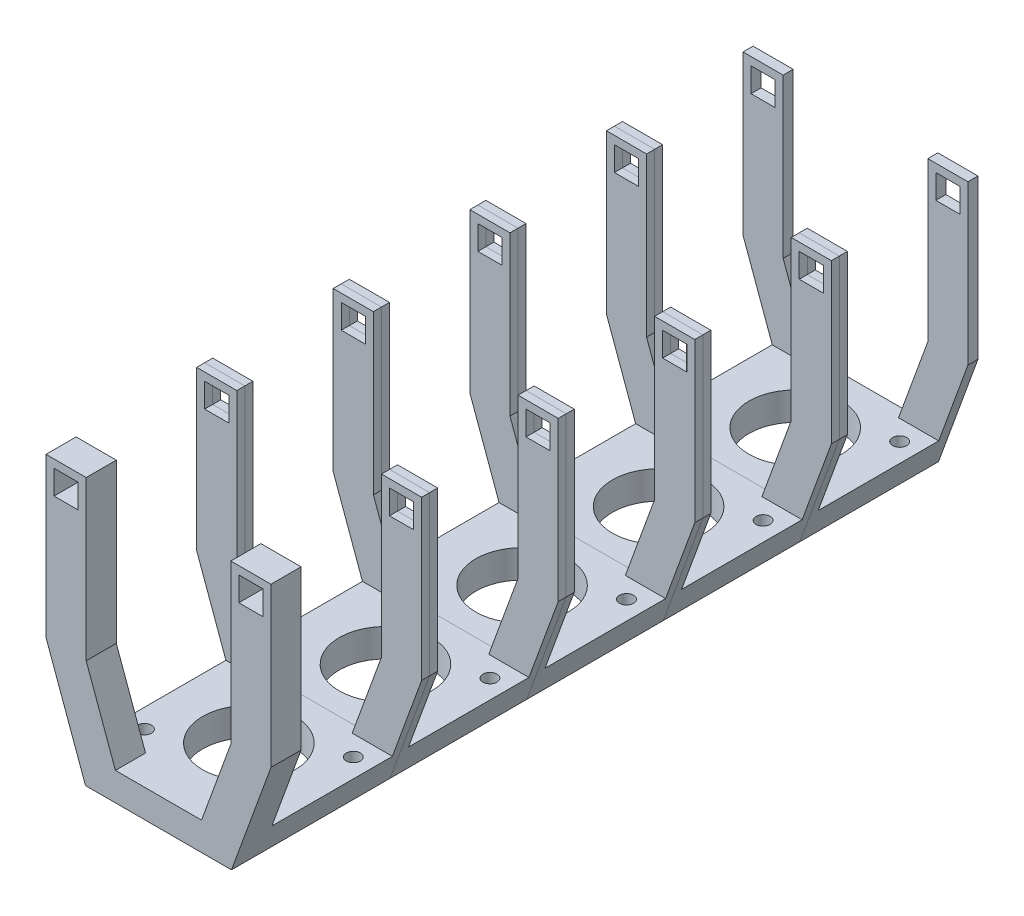
from build123d import *

# Parameters (mm, degrees)
SKETCH3_W           = 6
SKETCH3_H           = 6
BOSS_EXTRUDE1_DEPTH = 2
BOSS_EXTRUDE2_DEPTH = 30
SKETCH4_W           = 6
SKETCH4_H           = 6
BOSS_EXTRUDE6_DEPTH = 2
LPATTERN7_COUNT     = 5
LPATTERN7_PITCH     = 34
SKETCH12_W          = 6
SKETCH12_H          = 6
BOSS_EXTRUDE7_DEPTH = 0.5
SKETCH13_W          = 6
SKETCH13_H          = 6
BOSS_EXTRUDE8_DEPTH = 2
SKETCH15_R          = 11.5
SKETCH15_R_2        = 1.75
CUT_EXTRUDE5_DEPTH  = 7
LPATTERN8_COUNT     = 5
LPATTERN8_PITCH     = 34
SKETCH16_W          = 6
SKETCH16_H          = 6
BOSS_EXTRUDE9_DEPTH = 3.5


with BuildPart() as part:
    # Sketch3 → Boss-Extrude1 (new body)
    with BuildSketch(Plane.XY):
        Polygon((12.279404685, -25), (5, -5), (5, 34.5), (-5, 34.5), (-5, -5), (4.827196325, -32), (41.172803675, -32), (51, -5), (51, 34.5), (41, 34.5), (41, -5), (33.720595315, -25), align=None)
        with Locations((0, 29.5)):
            Rectangle(SKETCH3_W, SKETCH3_H, mode=Mode.SUBTRACT)
        with Locations((46, 29.5)):
            Rectangle(SKETCH3_W, SKETCH3_H, mode=Mode.SUBTRACT)
    extrude(amount=BOSS_EXTRUDE1_DEPTH)

    # Sketch3<4> → Boss-Extrude2 (add)
    with BuildSketch(Plane.XY):
        Polygon((33.720595315, -25), (12.279404685, -25), (2.279404685, -25), (4.827196325, -32), (41.172803675, -32), (43.720595315, -25), align=None)
    extrude(amount=-BOSS_EXTRUDE2_DEPTH)

    # Sketch4 → Boss-Extrude6 (add)
    with BuildSketch(Plane(origin=(0, 0, -30), x_dir=(-1, 0, 0), z_dir=(0, 0, -1))):
        Polygon((5, -5), (5, 34.5), (-5, 34.5), (-5, -5), (-12.279404685, -25), (-33.720595315, -25), (-41, -5), (-41, 34.5), (-51, 34.5), (-51, -5), (-43.720595315, -25), (-41.172803675, -32), (-4.827196325, -32), (-2.279404685, -25), align=None)
        with Locations((0, 29.5)):
            Rectangle(SKETCH4_W, SKETCH4_H, mode=Mode.SUBTRACT)
        with Locations((-46, 29.5)):
            Rectangle(SKETCH4_W, SKETCH4_H, mode=Mode.SUBTRACT)
    extrude(amount=BOSS_EXTRUDE6_DEPTH)


with BuildPart() as lpattern7_1:
    # LPattern7: pattern copy
    add(part.part.moved(Location(Vector(0, 0, 1) * (1 * LPATTERN7_PITCH))))


with BuildPart() as lpattern7_2:
    # LPattern7: pattern copy
    add(part.part.moved(Location(Vector(0, 0, 1) * (2 * LPATTERN7_PITCH))))


with BuildPart() as lpattern7_3:
    # LPattern7: pattern copy
    add(part.part.moved(Location(Vector(0, 0, 1) * (3 * LPATTERN7_PITCH))))


with BuildPart() as lpattern7_4:
    # LPattern7: pattern copy
    add(part.part.moved(Location(Vector(0, 0, 1) * (4 * LPATTERN7_PITCH))))

    # Sketch13 → Boss-Extrude8 (add)
    with BuildSketch(Plane.XY.offset(138)):
        Polygon((41, -5), (41, 34.5), (51, 34.5), (51, -5), (41.172803675, -32), (4.827196325, -32), (-5, -5), (-5, 34.5), (5, 34.5), (5, -5), (12.279404685, -25), (33.720595315, -25), align=None)
        with Locations((46, 29.5)):
            Rectangle(SKETCH13_W, SKETCH13_H, mode=Mode.SUBTRACT)
        with Locations((0, 29.5)):
            Rectangle(SKETCH13_W, SKETCH13_H, mode=Mode.SUBTRACT)
    extrude(amount=BOSS_EXTRUDE8_DEPTH)

    # Sketch15 → Cut-Extrude5 (cut)
    with BuildSketch(Plane(origin=(0, -25, 0), x_dir=(1, 0, 0), z_dir=(0, 1, 0))):
        with Locations(Location((23, -121, 0), (0, 0, 270))):
            Circle(SKETCH15_R)
        with Locations(Location((7, -131, 0), (0, 0, 270))):
            Circle(SKETCH15_R_2)
        with Locations(Location((39, -111, 0), (0, 0, 270))):
            Circle(SKETCH15_R_2)
    cut_extrude5 = extrude(amount=-CUT_EXTRUDE5_DEPTH, mode=Mode.SUBTRACT)

    # Sketch16 → Boss-Extrude9 (add)
    with BuildSketch(Plane.XY.offset(140)):
        Polygon((41.172803675, -32), (51, -5), (51, 34.5), (41, 34.5), (41, -5), (33.720595315, -25), (12.279404685, -25), (5, -5), (5, 34.5), (-5, 34.5), (-5, -5), (4.827196325, -32), align=None)
        with Locations((46, 29.5)):
            Rectangle(SKETCH16_W, SKETCH16_H, mode=Mode.SUBTRACT)
        with Locations((0, 29.5)):
            Rectangle(SKETCH16_W, SKETCH16_H, mode=Mode.SUBTRACT)
    extrude(amount=BOSS_EXTRUDE9_DEPTH)


with BuildPart() as part_1:
    add(part.part)

    # Sketch12 → Boss-Extrude7 (add)
    with BuildSketch(Plane(origin=(0, 0, -32), x_dir=(-1, 0, 0), z_dir=(0, 0, -1))):
        Polygon((-5, 34.5), (-5, -5), (-12.279404685, -25), (-33.720595315, -25), (-41, -5), (-41, 34.5), (-51, 34.5), (-51, -5), (-41.172803675, -32), (-4.827196325, -32), (5, -5), (5, 34.5), align=None)
        with Locations((0, 29.5)):
            Rectangle(SKETCH12_W, SKETCH12_H, mode=Mode.SUBTRACT)
        with Locations((-46, 29.5)):
            Rectangle(SKETCH12_W, SKETCH12_H, mode=Mode.SUBTRACT)
    extrude(amount=BOSS_EXTRUDE7_DEPTH)


with BuildPart() as lpattern8_tool:
    # LPattern8: Cut-Extrude5 ×5
    with Locations(*[(0, 0, -i * LPATTERN8_PITCH) for i in range(1, LPATTERN8_COUNT)]):
        add(cut_extrude5)


with BuildPart() as part_2:
    add(part_1.part)

    # LPattern8: cut by lpattern8_tool
    add(lpattern8_tool.part, mode=Mode.SUBTRACT)


with BuildPart() as lpattern7_1_1:
    add(lpattern7_1.part)

    # LPattern8: cut by lpattern8_tool
    add(lpattern8_tool.part, mode=Mode.SUBTRACT)


with BuildPart() as lpattern7_2_1:
    add(lpattern7_2.part)

    # LPattern8: cut by lpattern8_tool
    add(lpattern8_tool.part, mode=Mode.SUBTRACT)


with BuildPart() as lpattern7_3_1:
    add(lpattern7_3.part)

    # LPattern8: cut by lpattern8_tool
    add(lpattern8_tool.part, mode=Mode.SUBTRACT)


solid = Compound([lpattern7_4.part, part_2.part, lpattern7_1_1.part, lpattern7_2_1.part, lpattern7_3_1.part])
